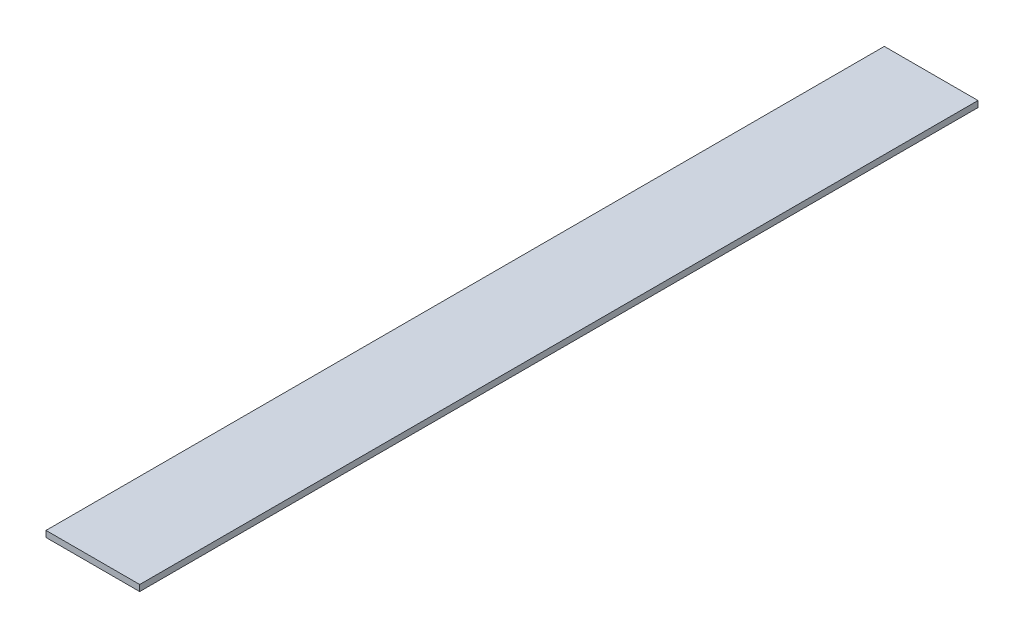
from build123d import *

# Parameters (mm, degrees)
KAPYAG_TABAN_PLAKASI_KAPALI_1_START = -20
SKETCH1_W                           = 76
SKETCH1_H                           = 5
KAPYAG_TABAN_PLAKASI_KAPALI_1_DEPTH = 680


with BuildPart() as part:
    # Sketch1 → KAPYAG_taban_plakasi_kapali_1 (new body)
    with BuildSketch(Plane.XY.offset(KAPYAG_TABAN_PLAKASI_KAPALI_1_START)):
        with Locations((0, 27.5)):
            Rectangle(SKETCH1_W, SKETCH1_H)
    extrude(amount=-KAPYAG_TABAN_PLAKASI_KAPALI_1_DEPTH)


solid = part.part
